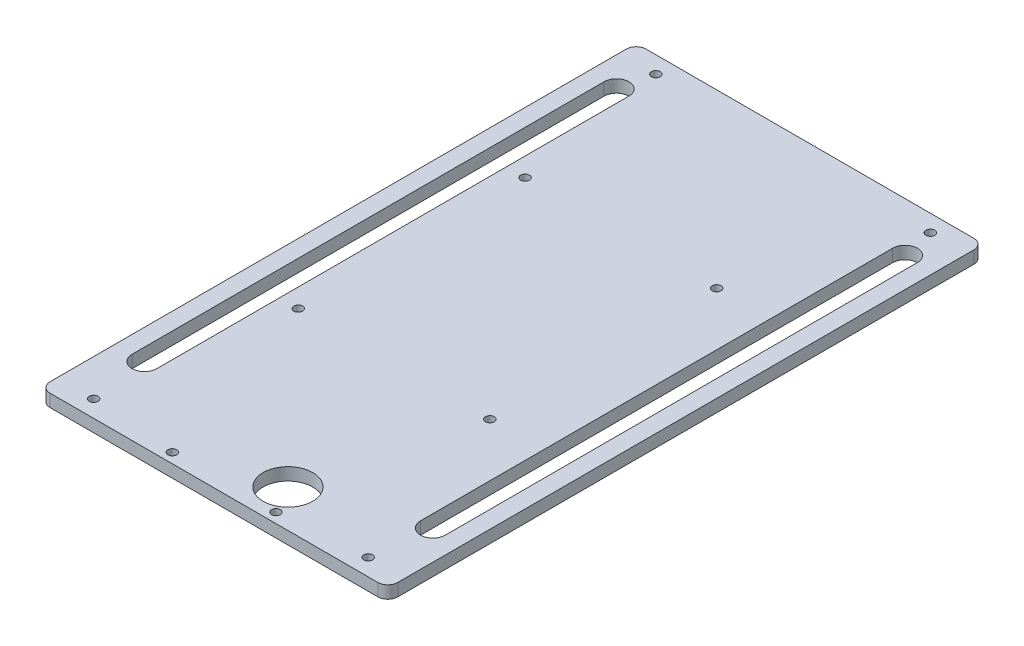
from build123d import *

# Parameters (mm, degrees)
SKETCH2_W           = 88.9
SKETCH2_H           = 3.2004
BOSS_EXTRUDE1_DEPTH = 152.4
SKETCH3_R           = 1.1303
SKETCH3_R_2         = 6.35
CUT_EXTRUDE1_DEPTH  = 160.245032004
FILLET2_R           = 2.54


with BuildPart() as part:
    # Sketch2 → Boss-Extrude1 (new body)
    with BuildSketch(Plane.XY):
        with Locations((-1.625781684, -22.993244248)):
            Rectangle(SKETCH2_W, SKETCH2_H)
    extrude(amount=BOSS_EXTRUDE1_DEPTH)

    # Sketch3 → Cut-Extrude1 (cut, through all)
    with BuildSketch(Plane(origin=(0, -21.393044248, 0), x_dir=(-1, 0, 0), z_dir=(0, 1, 0))):
        with Locations(Location((14.833781684, 149.86, 0), (0, 0, 90))):
            Circle(SKETCH3_R)
        with Locations(Location((-11.683818316, 149.86, 0), (0, 0, 90))):
            Circle(SKETCH3_R)
        with Locations(Location((-7.619818316, 142.748, 0), (0, 0, 90))):
            Circle(SKETCH3_R_2)
        with Locations(Location((-33.478453416, 148.082, 0), (0, 0, 90))):
            Circle(SKETCH3_R)
        with Locations(Location((36.730016784, 148.082, 0), (0, 0, 90))):
            Circle(SKETCH3_R)
        with Locations(Location((-33.478453416, 4.318, 0), (0, 0, 90))):
            Circle(SKETCH3_R)
        with Locations(Location((36.730016784, 4.318, 0), (0, 0, 90))):
            Circle(SKETCH3_R)
        with Locations(Location((-18.450986138, 43.949273109, 0), (0, 0, 90))):
            Circle(SKETCH3_R)
        with Locations(Location((-18.450986138, 101.949273109, 0), (0, 0, 90))):
            Circle(SKETCH3_R)
        with Locations(Location((30.549013862, 101.949273109, 0), (0, 0, 90))):
            Circle(SKETCH3_R)
        with Locations(Location((30.549013862, 43.949273109, 0), (0, 0, 90))):
            Circle(SKETCH3_R)
        with BuildLine():
            Line((35.32929924, 12.595958552), (35.32929924, 133.302587666))
            ThreePointArc((35.32929924, 133.302587666), (38.50429924, 136.477587666), (41.67929924, 133.302587666))
            Line((41.67929924, 133.302587666), (41.67929924, 12.595958552))
            ThreePointArc((41.67929924, 12.595958552), (38.50429924, 9.420958552), (35.32929924, 12.595958552))
        make_face()
        with BuildLine():
            Line((-32.077735872, 12.595958552), (-32.077735872, 133.302587666))
            ThreePointArc((-32.077735872, 133.302587666), (-35.252735872, 136.477587666), (-38.427735872, 133.302587666))
            Line((-38.427735872, 133.302587666), (-38.427735872, 12.595958552))
            ThreePointArc((-38.427735872, 12.595958552), (-35.252735872, 9.420958552), (-32.077735872, 12.595958552))
        make_face()
    extrude(amount=-CUT_EXTRUDE1_DEPTH, mode=Mode.SUBTRACT)

    # Fillet2
    fillet2_edges = [part.edges().sort_by_distance(p)[0] for p in [
        (42.824218316, -22.993244248, 152.4),
        (-46.075781684, -22.993244248, 152.4),
        (42.824218316, -22.993244248, 0),
        (-46.075781684, -22.993244248, 0),
    ]]
    fillet(fillet2_edges, radius=FILLET2_R)


solid = part.part
